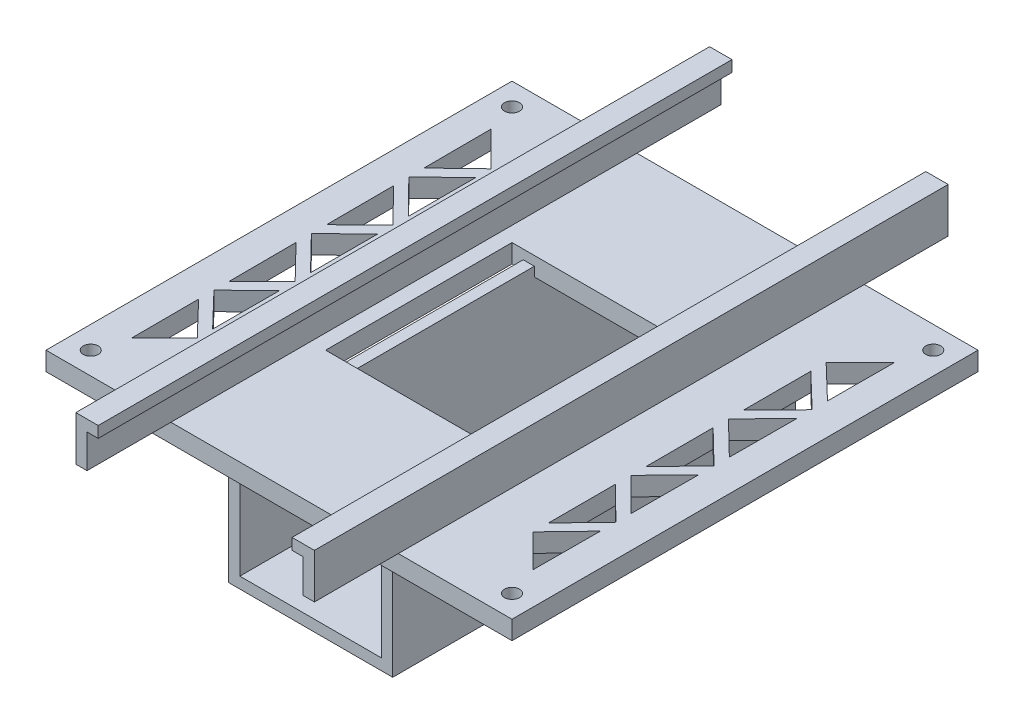
from build123d import *

# Parameters (mm, degrees)
SKETCH_2_W               = 125
SKETCH_2_H               = 125
SKETCH_2_R               = 2
SKETCH_2_W_2             = 50
SKETCH_2_H_2             = 50
EXTRUDE_1_DEPTH          = 2.5
EXTRUDE_4_DEPTH          = 54
CUT_EXTRUDE_2_DEPTH      = 97.210706265
CUT_EXTRUDE_2_DEPTH_BACK = 5
EXTRUDE_7_DEPTH          = 85


with BuildPart() as part:
    # 스케치2 → 보스-돌출1 (new, symmetric)
    with BuildSketch(Plane(origin=(0, 0, 0), x_dir=(1, 0, 0), z_dir=(0, 1, 0))):
        Rectangle(SKETCH_2_W, SKETCH_2_H)
        with Locations((-56.5, 56.5)):
            Circle(SKETCH_2_R, mode=Mode.SUBTRACT)
        with Locations((56.5, 56.5)):
            Circle(SKETCH_2_R, mode=Mode.SUBTRACT)
        with Locations((-56.5, -56.5)):
            Circle(SKETCH_2_R, mode=Mode.SUBTRACT)
        with Locations((56.5, -56.5)):
            Circle(SKETCH_2_R, mode=Mode.SUBTRACT)
        Rectangle(SKETCH_2_W_2, SKETCH_2_H_2, mode=Mode.SUBTRACT)
    extrude(amount=EXTRUDE_1_DEPTH, both=True)

    # 스케치6 → 보스-돌출4 (add, symmetric)
    with BuildSketch(Plane.XY):
        Polygon((-22, 0), (-22, -35.5), (22, -35.5), (22, 0), (19, 0), (19, -32.5), (-19, -32.5), (-19, 0), align=None)
    extrude(amount=EXTRUDE_4_DEPTH, both=True)

    # 스케치8 → 컷-돌출2 (cut, two sides: drawn at the far end of the back side and taken through both)
    with BuildSketch(Plane(origin=(0, 2.5, 0), x_dir=(1, 0, 0), z_dir=(0, 1, 0)).offset(-CUT_EXTRUDE_2_DEPTH_BACK)):
        Polygon((54.07931581, 22.285580831), (54.015526938, 4.28569386), (44.986382589, 13.073341514), align=None)
        Polygon((53.829622097, -48.172767848), (45.041121619, -39.384267369), (53.893419828, -30.170381277), align=None)
        Polygon((45.036831341, -35.272800588), (45.018048518, -17.272810388), (53.90806007, -26.039210725), align=None)
        Polygon((44.95901306, 39.30215881), (54.172270373, 48.515416123), (54.1084815, 30.515529152), align=None)
        Polygon((53.922585518, -21.940432956), (45.013752114, -13.155472476), (53.986361248, -3.944254461), align=None)
        Polygon((45.009460593, -9.042814869), (54.001004771, 0.18784173), (44.99067777, 8.957175331), align=None)
        Polygon((44.982089846, 17.187170851), (54.093962598, 26.418598199), (44.963307022, 35.187161051), align=None)
        Polygon((-53.893419828, -30.170381277), (-53.829622097, -48.172767848), (-45.041121619, -39.384267369), align=None)
        Polygon((-45.009460593, -9.042814869), (-44.99067777, 8.957175331), (-54.001004771, 0.18784173), align=None)
        Polygon((-53.986361248, -3.944254461), (-53.922585518, -21.940432956), (-45.013752114, -13.155472476), align=None)
        Polygon((-44.982089846, 17.187170851), (-44.963307022, 35.187161051), (-54.093962598, 26.418598199), align=None)
        Polygon((-54.1084815, 30.515529152), (-44.95901306, 39.30215881), (-54.172270373, 48.515416123), align=None)
        Polygon((-44.986382589, 13.073341514), (-54.07931581, 22.285580831), (-54.015526938, 4.28569386), align=None)
        Polygon((-53.90806007, -26.039210725), (-45.018048518, -17.272810388), (-45.036831341, -35.272800588), align=None)
    extrude(amount=CUT_EXTRUDE_2_DEPTH + CUT_EXTRUDE_2_DEPTH_BACK, mode=Mode.SUBTRACT)

    # 스케치11 → 보스-돌출7 (add, symmetric)
    with BuildSketch(Plane.XY):
        Polygon((-32, 2.5), (-32, 14.5), (-26, 14.5), (-26, 11.5), (-29, 11.5), (-29, 2.5), align=None)
        Polygon((32, 2.5), (29, 2.5), (29, 11.5), (26, 11.5), (26, 14.5), (32, 14.5), align=None)
    extrude(amount=EXTRUDE_7_DEPTH, both=True)


solid = part.part
